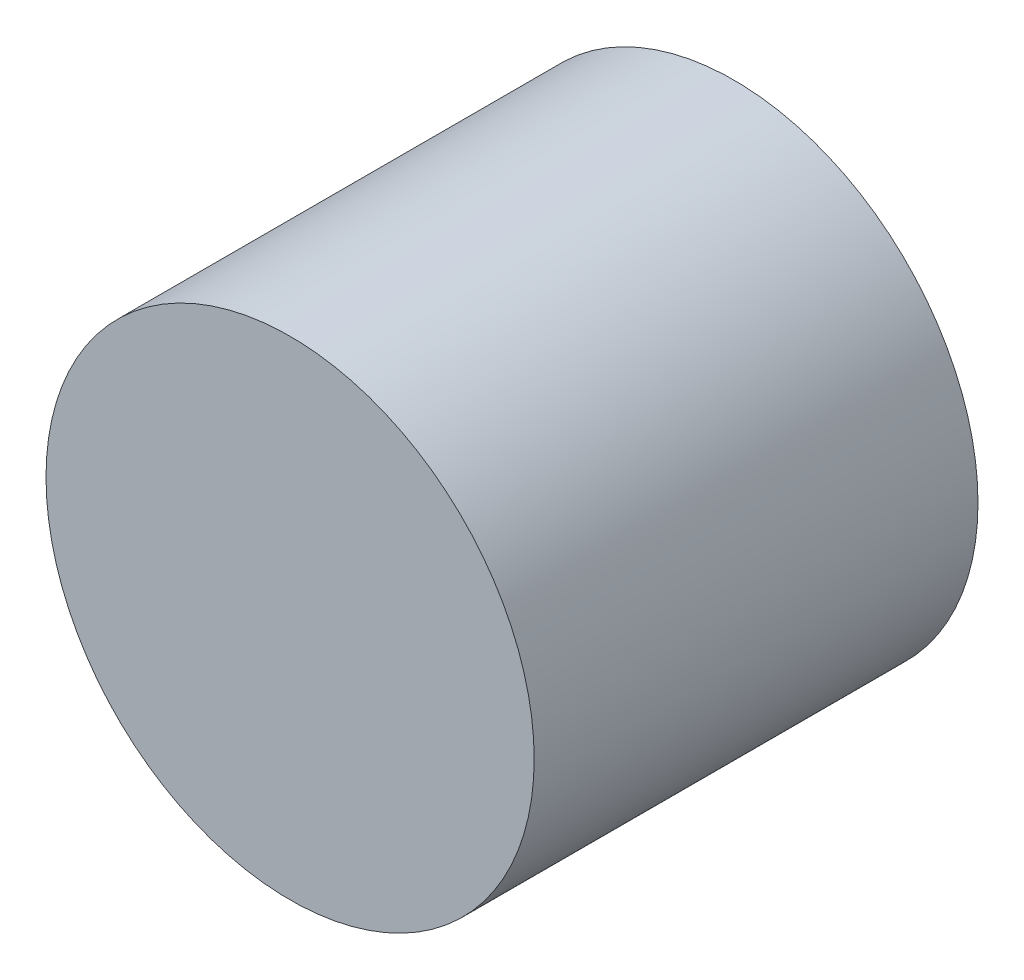
from build123d import *

# Parameters (mm, degrees)
ESQUISSE1_R        = 220
BOSS_EXTRU_1_DEPTH = 400


with BuildPart() as part:
    # Esquisse1 → Boss.-Extru.1 (new body)
    with BuildSketch(Plane.XY):
        Circle(ESQUISSE1_R)
    extrude(amount=BOSS_EXTRU_1_DEPTH)


solid = part.part
